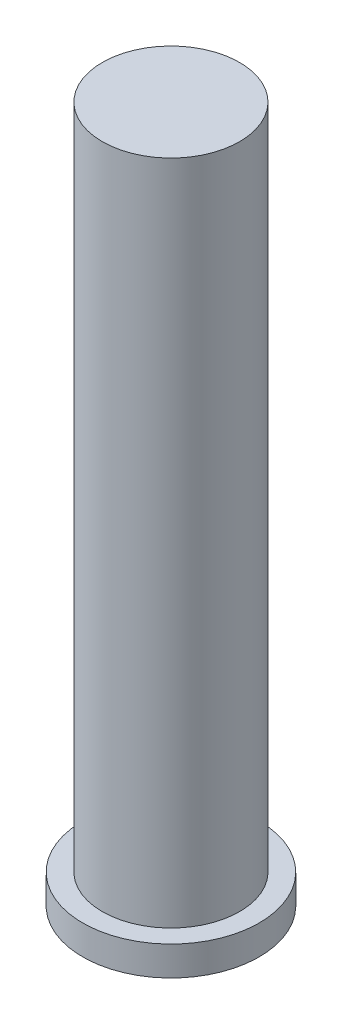
from build123d import *

# Parameters (mm, degrees)
SKETCH1_R           = 2.286
BOSS_EXTRUDE1_DEPTH = 0.762
SKETCH2_R           = 1.778
BOSS_EXTRUDE2_DEPTH = 17.272


with BuildPart() as part:
    # Sketch1 → Boss-Extrude1 (new body)
    with BuildSketch(Plane(origin=(0, 0, 0), x_dir=(1, 0, 0), z_dir=(0, 1, 0))):
        with Locations(Location((0, 0, 0), (0, 0, 90))):
            Circle(SKETCH1_R)
    extrude(amount=BOSS_EXTRUDE1_DEPTH)

    # Sketch2 → Boss-Extrude2 (add)
    with BuildSketch(Plane(origin=(0, 0.762, 0), x_dir=(1, 0, 0), z_dir=(0, 1, 0))):
        with Locations(Location((0, 0, 0), (0, 0, 270))):
            Circle(SKETCH2_R)
    extrude(amount=BOSS_EXTRUDE2_DEPTH)


solid = part.part
